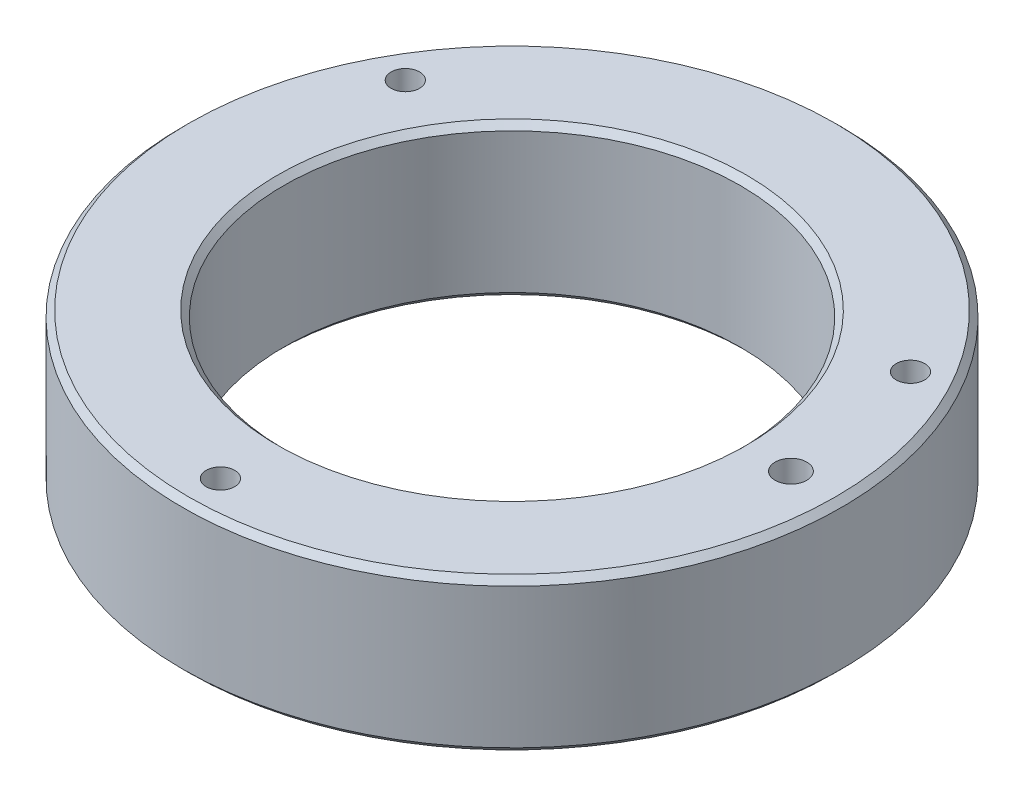
from build123d import *

# Parameters (mm, degrees)
SKETCH1_W                                        = 38.1
SKETCH1_H                                        = 25.3746
CBORE_FOR_1_4_SOCKET_HEAD_CAP_SCREW1_D           = 7.1374
CBORE_FOR_1_4_SOCKET_HEAD_CAP_SCREW1_DEPTH       = 38.1
CBORE_FOR_1_4_SOCKET_HEAD_CAP_SCREW1_CBORE_D     = 11.1252
CBORE_FOR_1_4_SOCKET_HEAD_CAP_SCREW1_CBORE_DEPTH = 9.652
CBORE_FOR_1_4_SOCKET_HEAD_CAP_SCREW1_TIP         = 2.144291291
F_3_8_16_TAPPED_HOLE1_D                          = 7.9375
F_3_8_16_TAPPED_HOLE1_DEPTH                      = 38.1
F_3_8_16_TAPPED_HOLE1_TIP                        = 2.384665582
CHAMFER1_SIZE                                    = 1.524


with BuildPart() as part:
    # Sketch1 → Revolve1 (revolve)
    with BuildSketch(Plane(origin=(0, 0, 0), x_dir=(0, 1, 0), z_dir=(0, 0, 1)), mode=Mode.PRIVATE) as revolve1_sk:
        with Locations((0, 69.8373)):
            Rectangle(SKETCH1_W, SKETCH1_H)
    revolve(revolve1_sk.sketch.rotate(Axis((0, -44.45, 0), (0, 1, 0)), 270), axis=Axis((0, -44.45, 0), (0, 1, 0)))

    # CBORE for 1/4 Socket Head Cap Screw1
    with Locations(Plane(origin=(0, -19.05, 0), x_dir=(-1, 0, 0), z_dir=(0, -1, 0))):
        with Locations((0, -73.025), (-63.246, 36.5252), (63.246, 36.5252)):
            CounterBoreHole(CBORE_FOR_1_4_SOCKET_HEAD_CAP_SCREW1_D / 2, CBORE_FOR_1_4_SOCKET_HEAD_CAP_SCREW1_CBORE_D / 2, CBORE_FOR_1_4_SOCKET_HEAD_CAP_SCREW1_CBORE_DEPTH, depth=CBORE_FOR_1_4_SOCKET_HEAD_CAP_SCREW1_DEPTH)
            with Locations((0, 0, -(CBORE_FOR_1_4_SOCKET_HEAD_CAP_SCREW1_DEPTH + CBORE_FOR_1_4_SOCKET_HEAD_CAP_SCREW1_TIP / 2))):  # 118° drill point
                Cone(0, CBORE_FOR_1_4_SOCKET_HEAD_CAP_SCREW1_D / 2, CBORE_FOR_1_4_SOCKET_HEAD_CAP_SCREW1_TIP, mode=Mode.SUBTRACT)

    # 3/8-16 Tapped Hole1
    with Locations(Plane(origin=(0, -19.05, 0), x_dir=(-1, 0, 0), z_dir=(0, -1, 0))):
        with Locations((-69.85, 0)):
            Hole(F_3_8_16_TAPPED_HOLE1_D / 2, depth=F_3_8_16_TAPPED_HOLE1_DEPTH)
            with Locations((0, 0, -(F_3_8_16_TAPPED_HOLE1_DEPTH + F_3_8_16_TAPPED_HOLE1_TIP / 2))):  # 118° drill point
                Cone(0, F_3_8_16_TAPPED_HOLE1_D / 2, F_3_8_16_TAPPED_HOLE1_TIP, mode=Mode.SUBTRACT)

    # Chamfer1
    chamfer1_edges = [part.edges().sort_by_distance(p)[0] for p in [
        (0, -19.05, 57.15),
        (0, 19.05, 57.15),
        (0, 19.05, 82.5246),
        (0, -19.05, 82.5246),
    ]]
    chamfer(chamfer1_edges, length=CHAMFER1_SIZE)


solid = part.part
